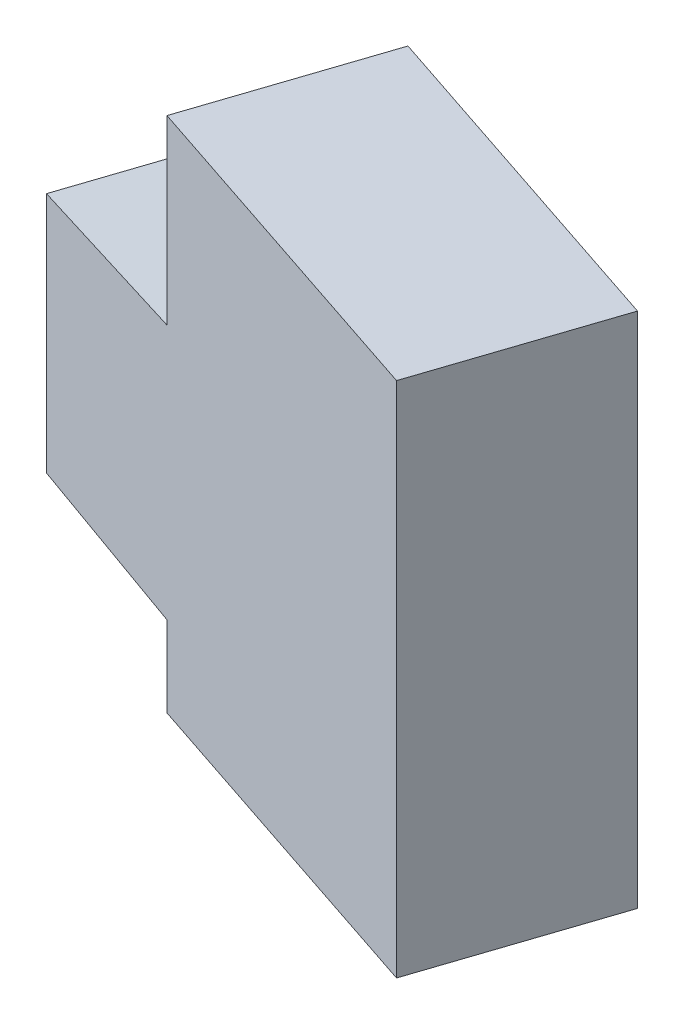
from build123d import *

# Parameters (mm, degrees)
BOSS_EXTRUDE1_DEPTH = 3


with BuildPart() as part:
    # Sketch1 → Boss-Extrude1 (new, symmetric)
    with BuildSketch(Plane(origin=(-6.35, 0, 19.05), x_dir=(0.9486832980505138, 0, 0.31622776601683805), z_dir=(-0.31622776601683805, 0, 0.9486832980505138))):
        Polygon((-45.241389426, 223.5962), (-33.811389426, 223.5962), (-33.811389426, 207.302150766), (-45.241389426, 207.302150766), (-45.241389426, 209.842150766), (-51.241389426, 210.051675383), (-51.241389426, 217.671675383), (-45.241389426, 217.8812), (-45.241389426, 220.4212), align=None)
    extrude(amount=BOSS_EXTRUDE1_DEPTH, both=True)


solid = part.part
